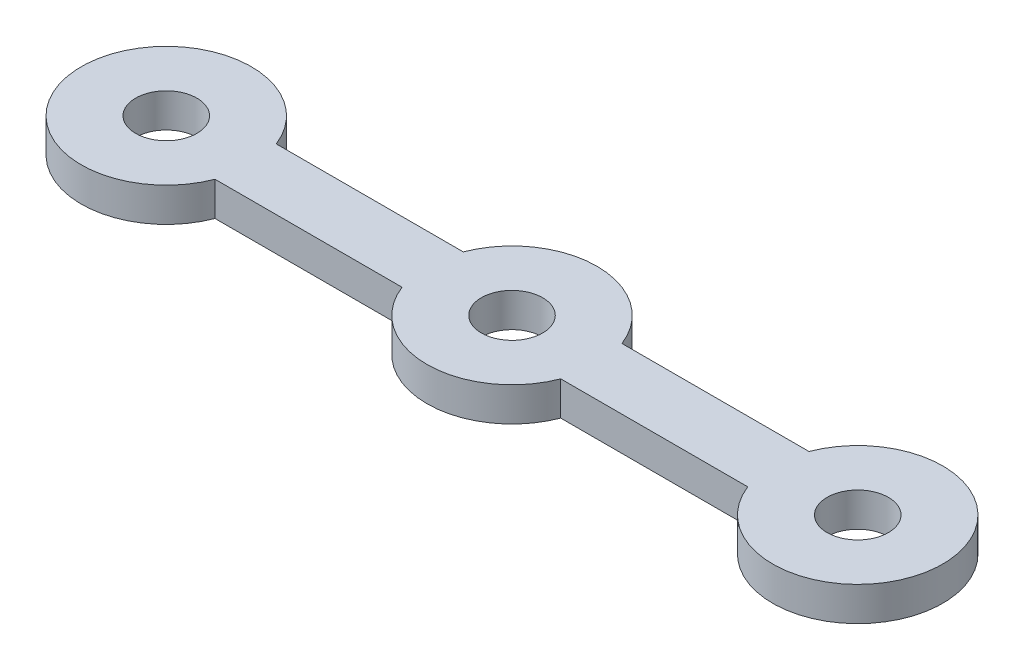
from build123d import *

# Parameters (mm, degrees)
SKETCH1_R           = 90
BOSS_EXTRUDE1_DEPTH = 100


with BuildPart() as part:
    # Sketch1 → Boss-Extrude1 (new body)
    with BuildSketch(Plane(origin=(0, 0, 0), x_dir=(1, 0, 0), z_dir=(0, 1, 0))):
        with BuildLine():
            ThreePointArc((233.238075794, 90), (-250, 0), (233.238075794, -90))
            Line((233.238075794, -90), (782.991924206, -90))
            ThreePointArc((782.991924206, -90), (1016.23, -250), (1249.468075794, -90))
            Line((1249.468075794, -90), (1799.221924206, -90))
            ThreePointArc((1799.221924206, -90), (2282.46, 0), (1799.221924206, 90))
            Line((1799.221924206, 90), (1249.468075794, 90))
            ThreePointArc((1249.468075794, 90), (1016.23, 250), (782.991924206, 90))
            Line((782.991924206, 90), (233.238075794, 90))
        make_face()
        with Locations(Location((1016.23, 0, 0), (0, 0, 270))):
            Circle(SKETCH1_R, mode=Mode.SUBTRACT)
        with Locations(Location((0, 0, 0), (0, 0, 270))):
            Circle(SKETCH1_R, mode=Mode.SUBTRACT)
        with Locations(Location((2032.46, 0, 0), (0, 0, 270))):
            Circle(SKETCH1_R, mode=Mode.SUBTRACT)
    extrude(amount=BOSS_EXTRUDE1_DEPTH)


solid = part.part
